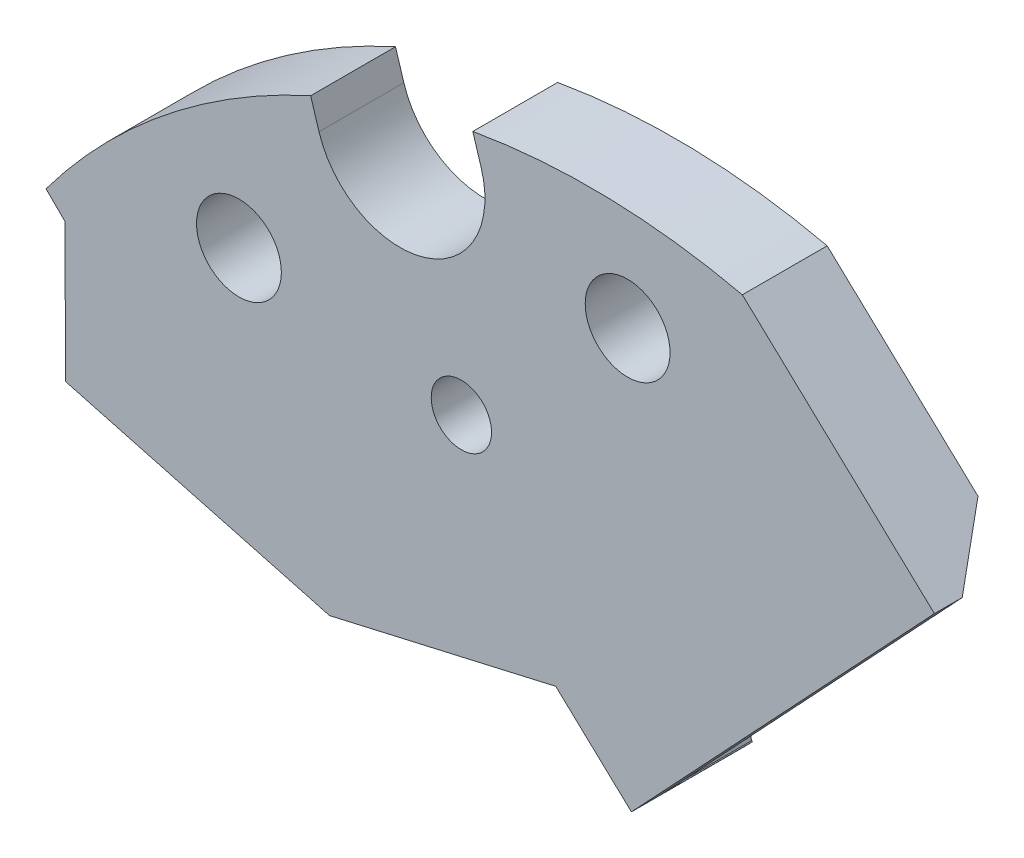
from build123d import *

# Parameters (mm, degrees)
ESTRUSIONE_ESTRUSIONE1_DEPTH = 9
ESTRUSIONE_SOTTILE1_DEPTH    = 3
ESTRUSIONE_ESTRUSIONE2_DEPTH = 3.5
SCHIZZO4_W                   = 9.5
SCHIZZO4_H                   = 0.5
ESTRUSIONE_ESTRUSIONE3_DEPTH = 0.1
ESTRUSIONE_ESTRUSIONE4_DEPTH = 24
SCHIZZO6_R                   = 4.5
SCHIZZO6_R_2                 = 3.2
TAGLIO_ESTRUSIONE1_DEPTH     = 81.740882068


with BuildPart() as part:
    # Schizzo1 → Estrusione-Estrusione1 (new body)
    with BuildSketch(Plane.XY):
        with BuildLine():
            Line((-3.647686021, 3.419705644), (0, 0))
            Line((0, 0), (32.145233057, 34.288248595))
            Line((32.145233057, 34.288248595), (16.145233057, 49.288248595))
            ThreePointArc((16.145233057, 49.288248595), (1.884416467, 51.07583724), (-12.447686021, 50.000104337))
            Line((-12.447686021, 50.000104337), (-11.562006013, 47.13559635))
            ThreePointArc((-11.562006013, 47.13559635), (-17.502963658, 35.876553995), (-28.762006013, 41.81751164))
            Line((-28.762006013, 41.81751164), (-29.647686021, 44.682019626))
            ThreePointArc((-29.647686021, 44.682019626), (-45.119453561, 35.169318817), (-57.724052903, 22.09296065))
            Line((-57.724052903, 22.09296065), (-55.714897525, 20.102116027))
            Line((-55.714897525, 20.102116027), (-55.647686021, 5.419705644))
            Line((-55.647686021, 5.419705644), (-27.647686021, -2.080294356))
            Line((-27.647686021, -2.080294356), (-3.647686021, 3.419705644))
        make_face()
    extrude(amount=ESTRUSIONE_ESTRUSIONE1_DEPTH)


with BuildPart() as body_2:
    # Schizzo2 → Estrusione-Sottile1 (new body)
    with BuildSketch(Plane.XY.offset(9)):
        Polygon((36.522456282, 30.184601821), (4.377223225, -4.103646773), (4.340746365, -4.069449717), (36.485979422, 30.218798878), align=None)
    extrude(amount=-ESTRUSIONE_SOTTILE1_DEPTH)


    add(part.part)  # loft1 joins it to this body
    # loft from a face of the part (loft1)
    loft([body_2.faces().sort_by_distance((20.413362893, 13.07467458, 7.5))[0], body_2.faces().sort_by_distance((16.072616529, 17.144124297, 4.5))[0]])

    # Schizzo3 → Estrusione-Estrusione2 (add)
    with BuildSketch(Plane(origin=(0, 0, 0), x_dir=(-1, 0, 0), z_dir=(0, 0, -1))):
        Polygon((0, 0), (3.647686021, 3.419705644), (14.243498137, 0.991498701), (15.137002762, 4.890427975), (2.465482621, 7.794318007), (-2.735764516, 2.918148817), align=None)
    extrude(amount=ESTRUSIONE_ESTRUSIONE2_DEPTH)

    # Schizzo4 → Estrusione-Estrusione3 (add)
    with BuildSketch(Plane(origin=(4.377223225, -4.103646773, 0), x_dir=(0, 0, -1), z_dir=(0.7295372041400824, -0.6839411288813327, 0))):
        with Locations((-1.25, 0.25)):
            Rectangle(SCHIZZO4_W, SCHIZZO4_H)
    extrude(amount=-ESTRUSIONE_ESTRUSIONE3_DEPTH)

    # loft from a face of the part (loft3)
    loft([body_2.faces().sort_by_distance((4.475254787, -3.852868359, 1.224789916))[0], body_2.faces().sort_by_distance((1.367882258, 1.459074408, -1.75))[0]])

    # Schizzo5 → Estrusione-Estrusione4 (add)
    with BuildSketch(Plane(origin=(0, 0, 0), x_dir=(-1, 0, 0), z_dir=(0, 0, -1))):
        Polygon((14.243498137, 0.991498701), (27.647686021, -2.080294356), (55.647686021, 5.419705644), (55.666665545, 9.565798886), (27.686647069, 2.07115108), (15.137002762, 4.890427975), align=None)
    extrude(amount=ESTRUSIONE_ESTRUSIONE4_DEPTH)

    # Schizzo6 → Taglio-Estrusione1 (cut, through all)
    with BuildSketch(Plane(origin=(0, 0, 0), x_dir=(-1, 0, 0), z_dir=(0, 0, -1))):
        with Locations((-3.975977763, 40.135945247)):
            Circle(SCHIZZO6_R)
        with Locations((13.659623442, 23.345827018)):
            Circle(SCHIZZO6_R_2)
        with Locations((37.256730628, 26.89249206)):
            Circle(SCHIZZO6_R)
    extrude(amount=-TAGLIO_ESTRUSIONE1_DEPTH, mode=Mode.SUBTRACT)


solid = body_2.part
